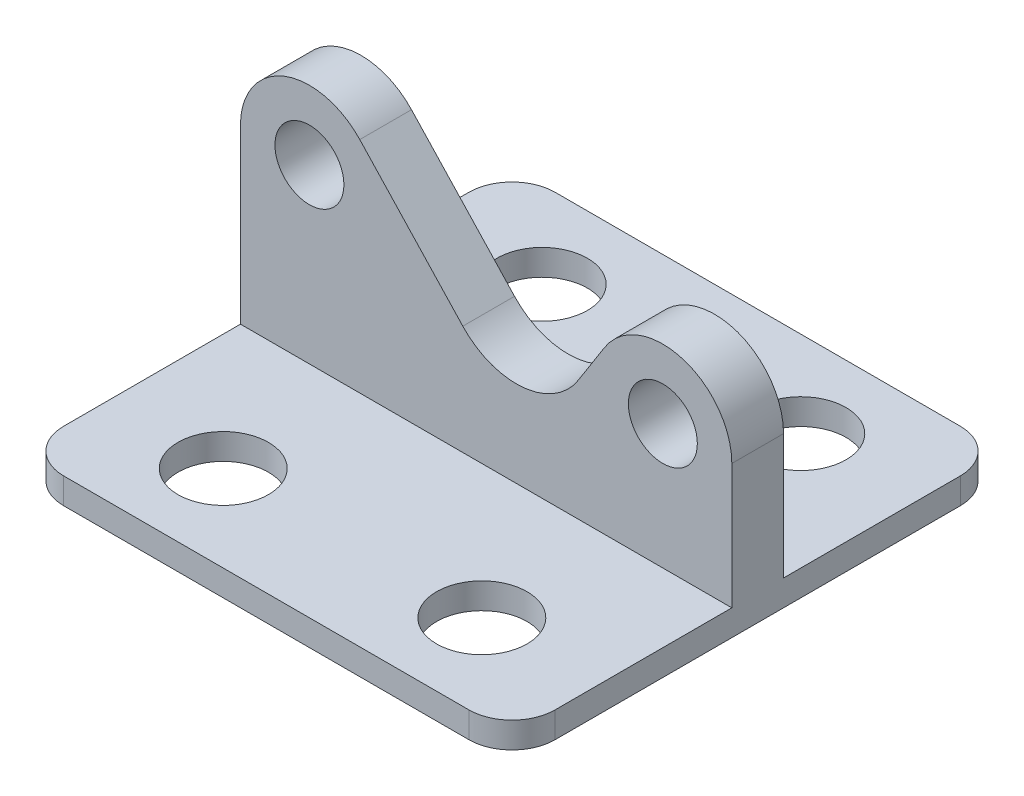
from build123d import *

# Parameters (mm, degrees)
EXTRUDE_1_DEPTH      = 3
EXTRUDE_1_DEPTH_BACK = 3
SKETCH_1_R           = 4
SKETCH_2_R           = 5.25
EXTRUDE_2_DEPTH      = 3


with BuildPart() as part:
    # 草图1 → 凸台-拉伸1 (new, two sides: drawn at the far end of the back side and taken through both)
    with BuildSketch(Plane.XY.offset(-EXTRUDE_1_DEPTH_BACK)):
        with BuildLine():
            Line((0, 0), (57, 0))
            Line((57, 0), (57, 17.5))
            ThreePointArc((57, 17.5), (51.229837516, 25.182956765), (42.243043837, 21.782936307))
            Line((42.243043837, 21.782936307), (39.179265923, 16.949380174))
            ThreePointArc((39.179265923, 16.949380174), (32.794593586, 13.037221435), (25.793283338, 15.692533403))
            Line((25.793283338, 15.692533403), (13.841615682, 28.465850915))
            ThreePointArc((13.841615682, 28.465850915), (5.061711847, 30.44086438), (0, 23))
            Line((0, 23), (0, 0))
        make_face()
        with Locations((49, 17.5)):
            Circle(SKETCH_1_R, mode=Mode.SUBTRACT)
        with Locations((8, 23)):
            Circle(SKETCH_1_R, mode=Mode.SUBTRACT)
    extrude(amount=EXTRUDE_1_DEPTH + EXTRUDE_1_DEPTH_BACK)

    # 草图2 → 凸台-拉伸2 (add)
    with BuildSketch(Plane(origin=(0, 0, 0), x_dir=(1, 0, 0), z_dir=(0, 1, 0))):
        with BuildLine():
            Line((5, -28.5), (52, -28.5))
            ThreePointArc((52, -28.5), (55.535533906, -27.035533906), (57, -23.5))
            Line((57, -23.5), (57, 23.5))
            ThreePointArc((57, 23.5), (55.535533906, 27.035533906), (52, 28.5))
            Line((52, 28.5), (5, 28.5))
            ThreePointArc((5, 28.5), (1.464466094, 27.035533906), (0, 23.5))
            Line((0, 23.5), (0, -23.5))
            ThreePointArc((0, -23.5), (1.464466094, -27.035533906), (5, -28.5))
        make_face()
        with Locations((43.5, -18.5)):
            Circle(SKETCH_2_R, mode=Mode.SUBTRACT)
        with Locations((43.5, 18.5)):
            Circle(SKETCH_2_R, mode=Mode.SUBTRACT)
        with Locations((13.5, -18.5)):
            Circle(SKETCH_2_R, mode=Mode.SUBTRACT)
        with Locations((13.5, 18.5)):
            Circle(SKETCH_2_R, mode=Mode.SUBTRACT)
    extrude(amount=EXTRUDE_2_DEPTH)


solid = part.part
